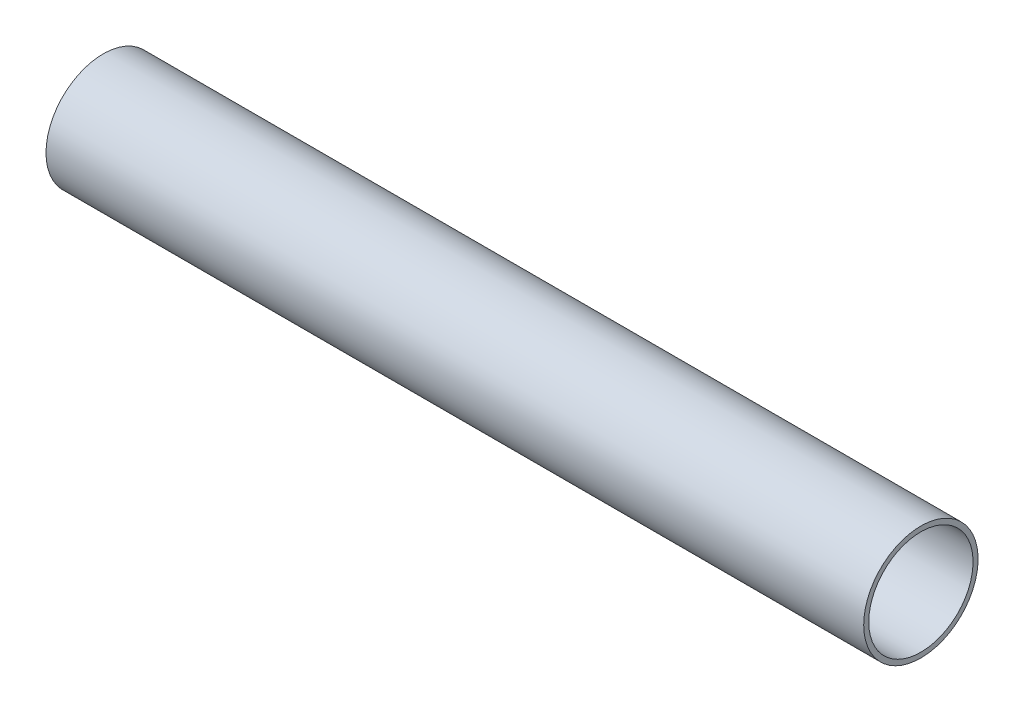
from build123d import *

# Parameters (mm, degrees)
SKETCH1_W = 243
SKETCH1_H = 1.5


with BuildPart() as part:
    # Sketch1 → Revolve1 (revolve)
    with BuildSketch(Plane.XY, mode=Mode.PRIVATE) as revolve1_sk:
        with Locations((121.5, -16.25)):
            Rectangle(SKETCH1_W, SKETCH1_H)
    revolve(revolve1_sk.sketch.rotate(Axis((0, 0, 0), (1, 0, 0)), 270), axis=Axis((0, 0, 0), (1, 0, 0)))


solid = part.part
